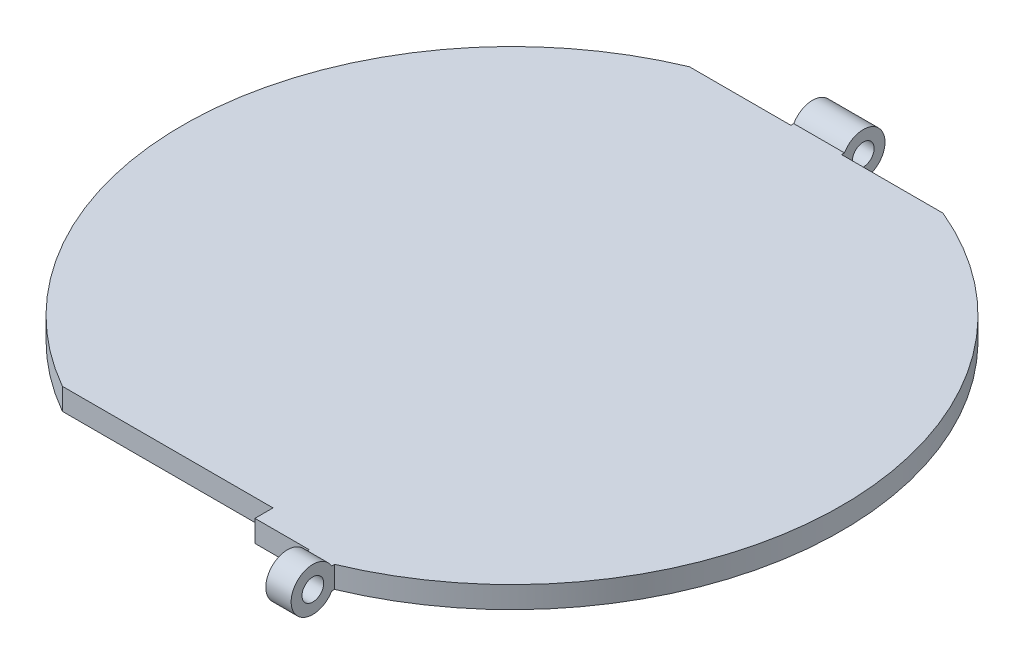
from build123d import *

# Parameters (mm, degrees)
BOSS_EXTRUDE1_DEPTH     = 3
BOSS_EXTRUDE2_START     = -10
SKETCH2_R               = 1.5
BOSS_EXTRUDE2_DEPTH     = 27.5
SKETCH3_W               = 8
SKETCH3_H               = 9
CUT_EXTRUDE1_DEPTH      = 24
SKETCH4_W               = 8
SKETCH4_H               = 9
CUT_EXTRUDE2_DEPTH      = 6.5
SKETCH5_W               = 7
SKETCH5_H               = 7
CUT_EXTRUDE3_DEPTH      = 14
CUT_EXTRUDE4_REACH      = 72.91
CUT_EXTRUDE4_END_RADIUS = 45.5
SKETCH6_W               = 11
SKETCH6_H               = 12


with BuildPart() as part:
    # Sketch1 → Boss-Extrude1 (new body)
    with BuildSketch(Plane(origin=(0, 0, 0), x_dir=(1, 0, 0), z_dir=(0, 1, 0))):
        with BuildLine():
            Line((-17.5, -42), (17.5, -42))
            ThreePointArc((17.5, -42), (45.5, 0), (17.5, 42))
            Line((17.5, 42), (-17.5, 42))
            ThreePointArc((-17.5, 42), (-45.5, 0), (-17.5, -42))
        make_face()
    extrude(amount=BOSS_EXTRUDE1_DEPTH)

    # Sketch2 → Boss-Extrude2 (add)
    with BuildSketch(Plane(origin=(0, 0, 0), x_dir=(0, 0, -1), z_dir=(1, 0, 0)).offset(BOSS_EXTRUDE2_START)):
        with BuildLine():
            Line((-42, 0), (-42.401923789, 0))
            ThreePointArc((-42.401923789, 0), (-48, 1.5), (-42.401923789, 3))
            Line((-42.401923789, 3), (-42, 3))
            Line((-42, 3), (-42, 1.5))
            Line((-42, 1.5), (-42, 0))
        make_face()
        with Locations((-45, 1.5)):
            Circle(SKETCH2_R, mode=Mode.SUBTRACT)
    boss_extrude2 = extrude(amount=BOSS_EXTRUDE2_DEPTH)

    # Mirror1: Boss-Extrude2 across plane
    add(boss_extrude2.mirror(Plane.XY))

    # Sketch3 → Cut-Extrude1 (cut)
    with BuildSketch(Plane.ZY.offset(10)):
        with Locations((46, 2)):
            Rectangle(SKETCH3_W, SKETCH3_H)
    extrude(amount=-CUT_EXTRUDE1_DEPTH, mode=Mode.SUBTRACT)

    # Sketch4 → Cut-Extrude2 (cut)
    with BuildSketch(Plane.ZY.offset(10)):
        with Locations((-46, 2)):
            Rectangle(SKETCH4_W, SKETCH4_H)
    extrude(amount=-CUT_EXTRUDE2_DEPTH, mode=Mode.SUBTRACT)

    # Sketch5 → Cut-Extrude3 (cut)
    with BuildSketch(Plane(origin=(17.5, 0, 0), x_dir=(0, 0, -1), z_dir=(1, 0, 0))):
        with Locations((45.5, 1.589580261)):
            Rectangle(SKETCH5_W, SKETCH5_H)
    extrude(amount=-CUT_EXTRUDE3_DEPTH, mode=Mode.SUBTRACT)

    # Cut-Extrude4: up to this cylinder (the profile starts inside it)
    cut_extrude4_end = Plane(origin=(0, 1.5, 0), z_dir=(0, -1, 0)) * Cylinder(CUT_EXTRUDE4_END_RADIUS, 237.82, mode=Mode.PRIVATE)
    # Sketch6 → Cut-Extrude4 (cut, up to the surface)
    with BuildSketch(Plane.ZY.offset(-6.5), mode=Mode.PRIVATE) as cut_extrude4_sk1:
        with Locations((45, 1.5)):
            Rectangle(SKETCH6_W, SKETCH6_H)
    cut_extrude4_tool1 = extrude(cut_extrude4_sk1.sketch, amount=CUT_EXTRUDE4_REACH, mode=Mode.PRIVATE) & cut_extrude4_end
    add(cut_extrude4_tool1.solids().sort_by_distance((6.5, 1.5, 45))[0], mode=Mode.SUBTRACT)


solid = part.part
